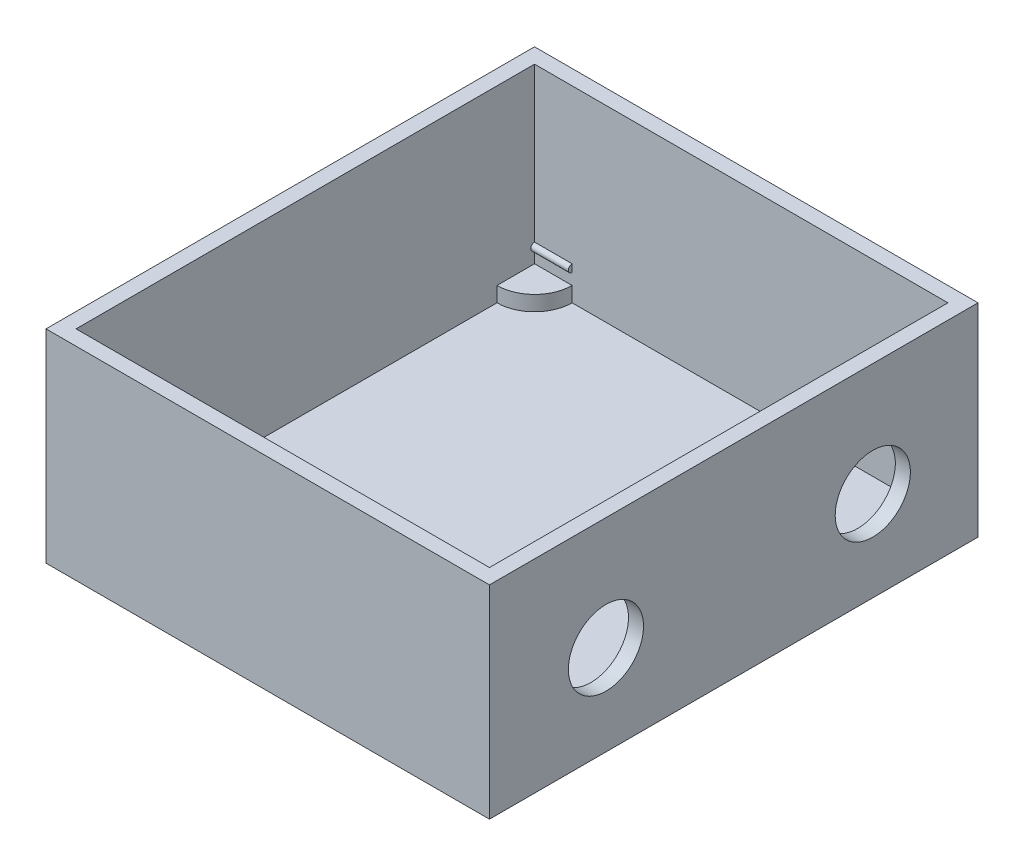
from build123d import *

# Parameters (mm, degrees)
SKETCH_1_W          = 59
SKETCH_1_H          = 65
SKETCH_1_W_2        = 55
SKETCH_1_H_2        = 61
EXTRUDE_1_DEPTH     = 25
SKETCH_2_W          = 59
SKETCH_2_H          = 65
EXTRUDE_2_DEPTH     = 2
EXTRUDE_3_DEPTH     = 2
SKETCH_4_R          = 5
CUT_EXTRUDE_1_DEPTH = 71.215738976
SKETCH_5_W          = 5
SKETCH_5_H          = 0.5
REVOLVE_1_ANGLE     = 180
SKETCH_7_W          = 5
SKETCH_7_H          = 0.5
REVOLVE_2_ANGLE     = 180


with BuildPart() as part:
    # Эскиз1 → Бобышка-Вытянуть1 (new body)
    with BuildSketch(Plane(origin=(0, 0, 0), x_dir=(1, 0, 0), z_dir=(0, 1, 0))):
        Rectangle(SKETCH_1_W, SKETCH_1_H)
        Rectangle(SKETCH_1_W_2, SKETCH_1_H_2, mode=Mode.SUBTRACT)
    extrude(amount=EXTRUDE_1_DEPTH)

    # Эскиз2 → Бобышка-Вытянуть2 (add)
    with BuildSketch(Plane.XZ):
        Rectangle(SKETCH_2_W, SKETCH_2_H)
    extrude(amount=EXTRUDE_2_DEPTH)

    # Эскиз3 → Бобышка-Вытянуть3 (add)
    with BuildSketch(Plane(origin=(0, 0, 0), x_dir=(1, 0, 0), z_dir=(0, 1, 0))):
        with BuildLine():
            Line((-27.5, 25.5), (-27.5, 30.5))
            Line((-27.5, 30.5), (-22.5, 30.5))
            ThreePointArc((-22.5, 30.5), (-23.964466094, 26.964466094), (-27.5, 25.5))
        make_face()
        with BuildLine():
            Line((27.5, 30.5), (22.5, 30.5))
            ThreePointArc((22.5, 30.5), (23.964466094, 26.964466094), (27.5, 25.5))
            Line((27.5, 25.5), (27.5, 30.5))
        make_face()
        with BuildLine():
            Line((27.5, -25.5), (27.5, -30.5))
            Line((27.5, -30.5), (22.5, -30.5))
            ThreePointArc((22.5, -30.5), (23.964466094, -26.964466094), (27.5, -25.5))
        make_face()
        with BuildLine():
            Line((-27.5, -25.5), (-27.5, -30.5))
            Line((-27.5, -30.5), (-22.5, -30.5))
            ThreePointArc((-22.5, -30.5), (-23.964466094, -26.964466094), (-27.5, -25.5))
        make_face()
    extrude(amount=EXTRUDE_3_DEPTH)

    # Эскиз4 → Вырез-Вытянуть1 (cut, through all)
    with BuildSketch(Plane.ZY.offset(-27.5)):
        with Locations((17, 10)):
            Circle(SKETCH_4_R)
        with Locations((-18.5, 10)):
            Circle(SKETCH_4_R)
    extrude(amount=-CUT_EXTRUDE_1_DEPTH, mode=Mode.SUBTRACT)

    # Эскиз5 → Повернуть1 (revolve)
    with BuildSketch(Plane(origin=(0, 0, 30.5), x_dir=(-1, 0, 0), z_dir=(0, 0, -1))):
        with Locations((-25, 3.75)):
            Rectangle(SKETCH_5_W, SKETCH_5_H)
        with Locations((25, 3.75)):
            Rectangle(SKETCH_5_W, SKETCH_5_H)
    revolve(axis=Axis((27.5, 4, 30.5), (1, 0, 0)), revolution_arc=REVOLVE_1_ANGLE)

    # Эскиз7 → Повернуть2 (revolve)
    with BuildSketch(Plane.XY.offset(-30.5)):
        with Locations((-25, 3.75)):
            Rectangle(SKETCH_7_W, SKETCH_7_H)
        with Locations((25, 3.75)):
            Rectangle(SKETCH_7_W, SKETCH_7_H)
    revolve(axis=Axis((-27.5, 4, -30.5), (-1, 0, 0)), revolution_arc=REVOLVE_2_ANGLE)


solid = part.part
